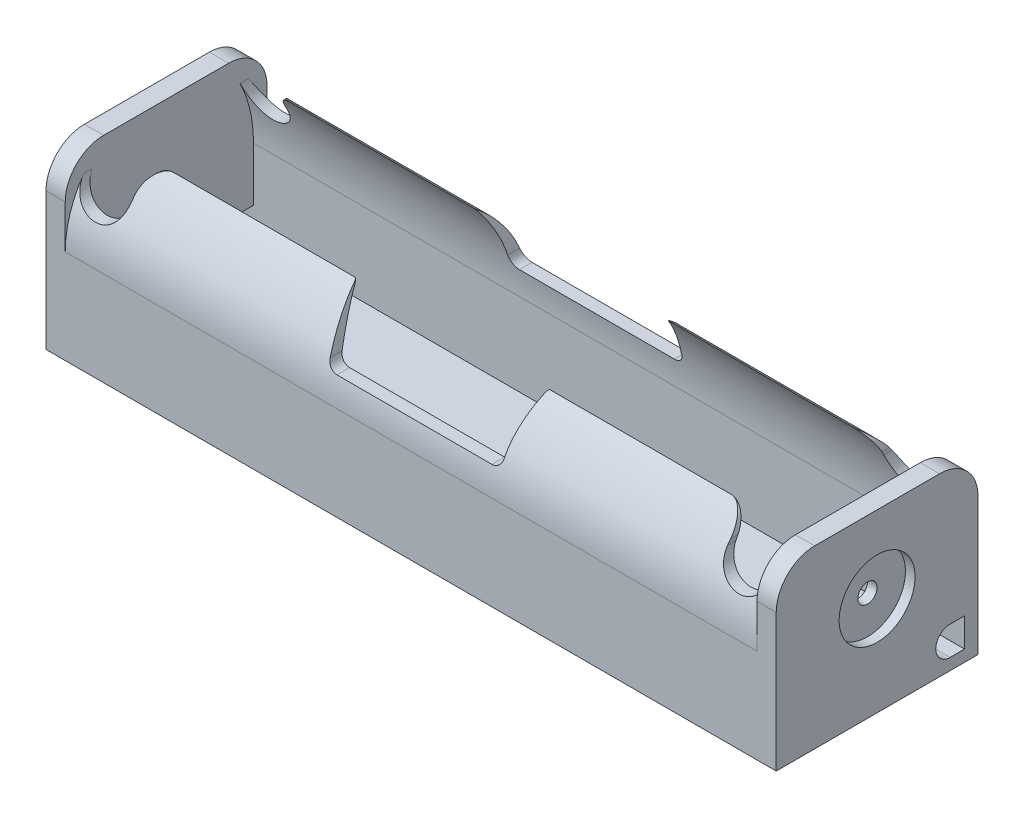
from build123d import *

# Parameters (mm, degrees)
SKETCH1_W                            = 76
SKETCH1_H                            = 21
BASE_DEPTH                           = 1.2
SKETCH2_W                            = 2
SKETCH2_H                            = 21
REAR_WALL_DEPTH                      = 17.1
SKETCH3_W                            = 2
SKETCH3_H                            = 21
FRONT_WALL_DEPTH                     = 17.1
SKETCH5_W                            = 76
SKETCH5_H                            = 1.4
SIDE_WALL_DEPTH                      = 9.8
RW_FW_FILLETS_R                      = 4
CURVED_WALL_REACH                    = 45.464
CURVED_WALL_DIRECTION_2_REACH        = 45.464
BATTERY_ENDS_ENCOMPASSMENT_CUT_DEPTH = 44.464238173
MID_CUT_DEPTH                        = 44.46423824
MID_CUT_DEPTH_BACK                   = 44.46423824
BEEC_FILLET_DEPTH                    = 44.46423824
SKETCH12_R                           = 3.95
LC_CUT_DEPTH                         = 1
SC_CUT_REACH                         = 79.911
SKETCH13_R                           = 1
SQUARE_PROFILE_CUT_BOTTOM_REACH      = 45.464
SKETCH14_W                           = 3
SKETCH14_H                           = 8
SKETCH15_R                           = 1.5
MIDDLE_HOLE_DEPTH                    = 43.972782148
SKETCH16_R                           = 2.6
MH_COUNTERBORE_DEPTH                 = 0.8
WIRE_ACCESS_DEPTH                    = 44.46423824
WIRE_ACCESS_DEPTH_BACK               = 44.46423824


with BuildPart() as part:
    # Sketch1 → BASE (new body)
    with BuildSketch(Plane(origin=(0, 0, 0), x_dir=(1, 0, 0), z_dir=(0, 1, 0))):
        Rectangle(SKETCH1_W, SKETCH1_H)
    extrude(amount=BASE_DEPTH)

    # Sketch2 → REAR WALL (add)
    with BuildSketch(Plane(origin=(0, 1.2, 0), x_dir=(1, 0, 0), z_dir=(0, 1, 0))):
        with Locations((-37, 0)):
            Rectangle(SKETCH2_W, SKETCH2_H)
    extrude(amount=REAR_WALL_DEPTH)

    # Sketch3 → FRONT WALL (add)
    with BuildSketch(Plane(origin=(0, 1.2, 0), x_dir=(1, 0, 0), z_dir=(0, 1, 0))):
        with Locations((37, 0)):
            Rectangle(SKETCH3_W, SKETCH3_H)
    extrude(amount=FRONT_WALL_DEPTH)

    # Sketch5 → SIDE WALL (add)
    with BuildSketch(Plane.XZ):
        with Locations((0, 9.8)):
            Rectangle(SKETCH5_W, SKETCH5_H)
    side_wall = extrude(amount=-SIDE_WALL_DEPTH)

    # RW FW FILLETS
    rw_fw_fillets_edges = [part.edges().sort_by_distance(p)[0] for p in [
        (-37, 18.3, -10.5),
        (-37, 18.3, 10.5),
        (37, 18.3, 10.5),
        (37, 18.3, -10.5),
    ]]
    fillet(rw_fw_fillets_edges, radius=RW_FW_FILLETS_R)

    # CURVED WALL: up to this face of the body (flat: up to its plane)
    curved_wall_end = Plane(part.part.faces().sort_by_distance((36, 9.74585717, -0.346838676))[0])
    # Sketch6 → CURVED WALL (add, up to the picked face)
    with BuildSketch(Plane(origin=(0, 0, 0), x_dir=(0, 0, -1), z_dir=(1, 0, 0)), mode=Mode.PRIVATE) as curved_wall_sk1:
        with BuildLine():
            Line((-10.5, 9.8), (-9.1, 9.8))
            ThreePointArc((-9.1, 9.8), (-8.355047518, 14.290545624), (-6.2, 18.3))
            ThreePointArc((-6.2, 18.3), (-9.363827185, 14.562877282), (-10.5, 9.8))
        make_face()
    curved_wall_tool1 = split(extrude(curved_wall_sk1.sketch, amount=CURVED_WALL_REACH, mode=Mode.PRIVATE), bisect_by=curved_wall_end, keep=Keep.BOTH, mode=Mode.PRIVATE)
    curved_wall = curved_wall_tool1.solids().sort_by(Axis((0, 13.210275, 9.072698), (1, 0, 0)))[0]
    add(curved_wall)

    # CURVED WALL direction 2: up to this face of the body (flat: up to its plane)
    curved_wall_direction_2_end = Plane(part.part.faces().sort_by_distance((-36, 9.74585717, -0.346838676))[0])
    # Sketch6 → CURVED WALL direction 2 (add, up to the picked face)
    with BuildSketch(Plane(origin=(0, 0, 0), x_dir=(0, 0, -1), z_dir=(1, 0, 0)), mode=Mode.PRIVATE) as curved_wall_direction_2_sk1:
        with BuildLine():
            Line((-10.5, 9.8), (-9.1, 9.8))
            ThreePointArc((-9.1, 9.8), (-8.355047518, 14.290545624), (-6.2, 18.3))
            ThreePointArc((-6.2, 18.3), (-9.363827185, 14.562877282), (-10.5, 9.8))
        make_face()
    curved_wall_direction_2_tool1 = split(extrude(curved_wall_direction_2_sk1.sketch, amount=-CURVED_WALL_DIRECTION_2_REACH, mode=Mode.PRIVATE), bisect_by=curved_wall_direction_2_end, keep=Keep.BOTH, mode=Mode.PRIVATE)
    curved_wall_direction_2 = curved_wall_direction_2_tool1.solids().sort_by(Axis((0, 13.210275, 9.072698), (-1, 0, 0)))[0]
    add(curved_wall_direction_2)

    # SW Mirror1: SIDE WALL, CURVED WALL, CURVED WALL direction 2 across plane
    add(side_wall.mirror(Plane.XY))
    add(curved_wall.mirror(Plane.XY))
    add(curved_wall_direction_2.mirror(Plane.XY))

    # Sketch8 → BATTERY ENDS ENCOMPASSMENT CUT (cut, symmetric)
    with BuildSketch(Plane.XY):
        with BuildLine():
            Line((-36, 15.9), (-36, 18.3))
            Line((-36, 18.3), (-29, 18.3))
            ThreePointArc((-29, 18.3), (-30.414213562, 17.714213562), (-31, 16.3))
            Line((-31, 16.3), (-31, 15.9))
            ThreePointArc((-31, 15.9), (-33.5, 13.4), (-36, 15.9))
        make_face()
    battery_ends_encompassment_cut = extrude(amount=BATTERY_ENDS_ENCOMPASSMENT_CUT_DEPTH, both=True, mode=Mode.SUBTRACT)

    # BEEC: BATTERY ENDS ENCOMPASSMENT CUT across plane
    add(battery_ends_encompassment_cut.mirror(Plane(origin=(0, 0, 0), x_dir=(0, 0, 1), z_dir=(1, 0, 0))), mode=Mode.SUBTRACT)

    # Sketch9 → MID CUT (cut, two sides: drawn at the far end of the back side and taken through both)
    with BuildSketch(Plane.XY.offset(-MID_CUT_DEPTH_BACK)):
        with BuildLine():
            Line((-8.06493845, 12.5), (8.06493845, 12.5))
            ThreePointArc((8.06493845, 12.5), (8.741000638, 12.763155432), (9.061243952, 13.414120165))
            ThreePointArc((9.061243952, 13.414120165), (9.403673525, 15.881451519), (10, 18.3))
            Line((10, 18.3), (9, 18.3))
            Line((9, 18.3), (-9, 18.3))
            Line((-9, 18.3), (-10, 18.3))
            ThreePointArc((-10, 18.3), (-9.403673525, 15.881451519), (-9.061243952, 13.414120165))
            ThreePointArc((-9.061243952, 13.414120165), (-8.741000638, 12.763155432), (-8.06493845, 12.5))
        make_face()
    extrude(amount=MID_CUT_DEPTH + MID_CUT_DEPTH_BACK, mode=Mode.SUBTRACT)

    # Sketch11 → BEEC FILLET (cut, symmetric)
    with BuildSketch(Plane.XY):
        with BuildLine():
            Line((-10, 18.3), (-10.186335722, 18.3))
            ThreePointArc((-10.186335722, 18.3), (-10.036541986, 18.250154532), (-9.946480561, 18.120494693))
            ThreePointArc((-9.946480561, 18.120494693), (-9.973065156, 18.21029956), (-10, 18.3))
        make_face()
    beec_fillet = extrude(amount=BEEC_FILLET_DEPTH, both=True, mode=Mode.SUBTRACT)

    # BEECF M: BEEC FILLET across plane
    add(beec_fillet.mirror(Plane(origin=(0, 0, 0), x_dir=(0, 0, 1), z_dir=(1, 0, 0))), mode=Mode.SUBTRACT)

    # Sketch12 → LC CUT (cut)
    with BuildSketch(Plane(origin=(38, 0, 0), x_dir=(0, 0, -1), z_dir=(1, 0, 0))):
        with Locations((0, 10.3)):
            Circle(SKETCH12_R)
    lc_cut = extrude(amount=-LC_CUT_DEPTH, mode=Mode.SUBTRACT)

    # Sketch13 → SC CUT (cut, up to next)
    with BuildSketch(Plane(origin=(37, 0, 0), x_dir=(0, 0, -1), z_dir=(1, 0, 0)), mode=Mode.PRIVATE) as sc_cut_sk1:
        with Locations((0, 10.3)):
            Circle(SKETCH13_R)
    sc_cut_tool1 = extrude(sc_cut_sk1.sketch, amount=-SC_CUT_REACH, mode=Mode.PRIVATE) & part.part
    sc_cut = sc_cut_tool1.solids().sort_by_distance((37, 10.3, 0))[0]
    add(sc_cut, mode=Mode.SUBTRACT)

    # Sketch14 → SQUARE PROFILE CUT BOTTOM (cut, up to next)
    with BuildSketch(Plane.XZ, mode=Mode.PRIVATE) as square_profile_cut_bottom_sk1:
        with Locations((34.5, 0)):
            Rectangle(SKETCH14_W, SKETCH14_H)
    square_profile_cut_bottom_tool1 = extrude(square_profile_cut_bottom_sk1.sketch, amount=-SQUARE_PROFILE_CUT_BOTTOM_REACH, mode=Mode.PRIVATE) & part.part
    square_profile_cut_bottom = square_profile_cut_bottom_tool1.solids().sort_by_distance((34.5, 0, 0))[0]
    add(square_profile_cut_bottom, mode=Mode.SUBTRACT)

    # LC SC SPCB MIRROR: LC CUT, SC CUT, SQUARE PROFILE CUT BOTTOM across plane
    add(lc_cut.mirror(Plane(origin=(0, 0, 0), x_dir=(0, 0, 1), z_dir=(1, 0, 0))), mode=Mode.SUBTRACT)
    add(sc_cut.mirror(Plane(origin=(0, 0, 0), x_dir=(0, 0, 1), z_dir=(1, 0, 0))), mode=Mode.SUBTRACT)
    add(square_profile_cut_bottom.mirror(Plane(origin=(0, 0, 0), x_dir=(0, 0, 1), z_dir=(1, 0, 0))), mode=Mode.SUBTRACT)

    # Sketch15 → MIDDLE HOLE (cut, through all)
    with BuildSketch(Plane(origin=(0, 1.2, 0), x_dir=(1, 0, 0), z_dir=(0, 1, 0))):
        with Locations(Location((0, 0, 0), (0, 0, 270))):
            Circle(SKETCH15_R)
    extrude(amount=-MIDDLE_HOLE_DEPTH, mode=Mode.SUBTRACT)

    # Sketch16 → MH COUNTERBORE (cut)
    with BuildSketch(Plane(origin=(0, 1.2, 0), x_dir=(1, 0, 0), z_dir=(0, 1, 0))):
        with Locations(Location((0, 0, 0), (0, 0, 270))):
            Circle(SKETCH16_R)
    extrude(amount=-MH_COUNTERBORE_DEPTH, mode=Mode.SUBTRACT)

    # Sketch17 → WIRE ACCESS (cut, two sides: drawn at the far end of the back side and taken through both)
    with BuildSketch(Plane(origin=(0, 0, 0), x_dir=(0, 0, -1), z_dir=(1, 0, 0)).offset(-WIRE_ACCESS_DEPTH_BACK)):
        with BuildLine():
            Line((9.1, 4.2), (9.1, 1.2))
            Line((9.1, 1.2), (7.6, 1.2))
            ThreePointArc((7.6, 1.2), (6.1, 2.7), (7.6, 4.2))
            Line((7.6, 4.2), (9.1, 4.2))
        make_face()
    extrude(amount=WIRE_ACCESS_DEPTH + WIRE_ACCESS_DEPTH_BACK, mode=Mode.SUBTRACT)


solid = part.part
